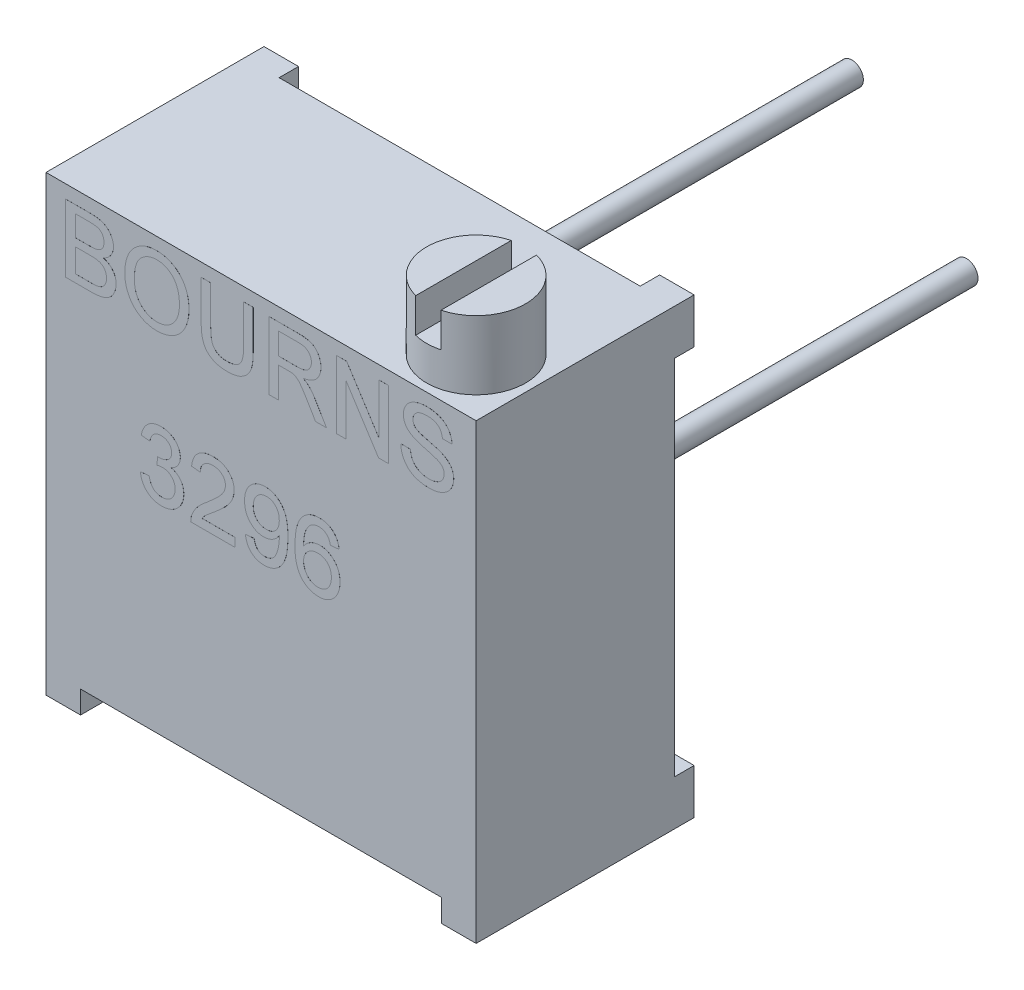
from build123d import *

# Parameters (mm, degrees)
SKETCH1_W          = 9.53
SKETCH1_H          = 10.03
EXTRUDE1_DEPTH     = 4.4
SKETCH2_W          = 8
SKETCH2_H          = 0.5
CUT_EXTRUDE1_DEPTH = 12.94429257
SKETCH3_W          = 0.765
SKETCH3_H          = 1
EXTRUDE2_DEPTH     = 0.43
SKETCH5_R          = 1.095
EXTRUDE4_DEPTH     = 1.52
SKETCH6_W          = 0.56
SKETCH6_H          = 3.177194403
CUT_EXTRUDE2_DEPTH = 0.76
EXTRUDE5_DEPTH     = 0.001
SKETCH8_R          = 0.255
EXTRUDE6_DEPTH     = 8.69


with BuildPart() as part:
    # Sketch1 → Extrude1 (new body)
    with BuildSketch(Plane.XY):
        with Locations((0, 5.015)):
            Rectangle(SKETCH1_W, SKETCH1_H)
    extrude(amount=EXTRUDE1_DEPTH)

    # Sketch2 → Cut-Extrude1 (cut, through all)
    with BuildSketch(Plane.XY.offset(4.4)):
        with Locations((0, 0.25)):
            Rectangle(SKETCH2_W, SKETCH2_H)
    extrude(amount=-CUT_EXTRUDE1_DEPTH, mode=Mode.SUBTRACT)

    # Sketch3 → Extrude2 (add)
    with BuildSketch(Plane(origin=(0, 0, 0), x_dir=(-1, 0, 0), z_dir=(0, 0, -1))):
        with Locations((-4.3825, 0.5)):
            Rectangle(SKETCH3_W, SKETCH3_H)
        with Locations((4.3825, 0.5)):
            Rectangle(SKETCH3_W, SKETCH3_H)
        with Locations((4.3825, 9.53)):
            Rectangle(SKETCH3_W, SKETCH3_H)
        with Locations((-4.3825, 9.53)):
            Rectangle(SKETCH3_W, SKETCH3_H)
    extrude(amount=EXTRUDE2_DEPTH)

    # Sketch5 → Extrude4 (add)
    with BuildSketch(Plane(origin=(0, 10.03, 0), x_dir=(-1, 0, 0), z_dir=(0, 1, 0))):
        with Locations(Location((-3.495, 3.13, 0), (0, 0, 270))):
            Circle(SKETCH5_R)
    extrude(amount=EXTRUDE4_DEPTH)

    # Sketch6 → Cut-Extrude2 (cut)
    with BuildSketch(Plane(origin=(0, 11.55, 0), x_dir=(-1, 0, 0), z_dir=(0, 1, 0))):
        with Locations((-3.495, 3.181606458)):
            Rectangle(SKETCH6_W, SKETCH6_H)
    extrude(amount=-CUT_EXTRUDE2_DEPTH, mode=Mode.SUBTRACT)

    # Sketch7 → Extrude5 (add)
    # profile 1 of 10: a face of its own
    with BuildSketch(Plane.XY.offset(4.4)):
        with BuildLine():
            Line((-4.326444342, 8.237150921), (-4.326444342, 9.737150921))
            Line((-4.326444342, 9.737150921), (-3.764845784, 9.737150921))
            add(Edge.make_bspline(
                [(-3.764845784, 9.737150921), (-3.750919069, 9.737097495), (-3.723744088, 9.736993245), (-3.684062996, 9.734386066), (-3.64648204, 9.730819986), (-3.610920315, 9.726223199), (-3.577531697, 9.719553354), (-3.5463473, 9.711473284), (-3.517204841, 9.702153183), (-3.481582627, 9.687955652), (-3.44053193, 9.666102632), (-3.396562734, 9.63349448), (-3.358307825, 9.594343785), (-3.326829661, 9.549455296), (-3.300895048, 9.501505925), (-3.282507712, 9.451409151), (-3.270751692, 9.400255705), (-3.269417834, 9.365618225), (-3.268752034, 9.348328806)],
                knots=[0, 0, 0, 0, 0.939712594, 1.833646414, 2.682508961, 3.487467313, 4.25240329, 4.978730417, 5.660668875, 6.315918528, 7.564895217, 8.787077865, 9.996481721, 11.241996224, 12.475862915, 13.665015424, 14.834484263, 16, 16, 16, 16], degree=3))
            add(Edge.make_bspline(
                [(-3.268752034, 9.348328806), (-3.26945193, 9.332243346), (-3.270844975, 9.300227505), (-3.281932051, 9.253066225), (-3.29943085, 9.207272915), (-3.324174647, 9.163404285), (-3.35580032, 9.122262901), (-3.395007125, 9.085240754), (-3.441231661, 9.052258501), (-3.475923175, 9.03467799), (-3.49381213, 9.025612459)],
                knots=[0, 0, 0, 0, 0.926741525, 1.844548388, 2.778836836, 3.746021974, 4.738420572, 5.759761325, 6.844803049, 8, 8, 8, 8], degree=3))
            add(Edge.make_bspline(
                [(-3.49381213, 9.025612459), (-3.482745904, 9.022148256), (-3.461080115, 9.015365935), (-3.429933293, 9.002955239), (-3.40069594, 8.988823885), (-3.373304413, 8.972948652), (-3.347943795, 8.955182527), (-3.324685642, 8.935497814), (-3.303368694, 8.914199128), (-3.284031035, 8.891299426), (-3.267044931, 8.866946071), (-3.251810517, 8.841671332), (-3.2392306, 8.815170846), (-3.228919301, 8.787513414), (-3.220874955, 8.758869935), (-3.215098238, 8.729130241), (-3.211805658, 8.698363557), (-3.211311122, 8.677463121), (-3.211059726, 8.666838421)],
                knots=[0, 0, 0, 0, 1.127427615, 2.20731145, 3.257257018, 4.283066884, 5.282973838, 6.264540225, 7.242620376, 8.210460609, 9.17525685, 10.12748095, 11.077310519, 12.023587065, 12.994999128, 13.967387486, 14.966724908, 16, 16, 16, 16], degree=3))
            add(Edge.make_bspline(
                [(-3.211059726, 8.666838421), (-3.211577892, 8.649780613), (-3.212604959, 8.615969962), (-3.220853456, 8.56620637), (-3.234792977, 8.518337989), (-3.253979542, 8.473138792), (-3.276841107, 8.43134548), (-3.302824076, 8.394052338), (-3.331265831, 8.36164311), (-3.362967261, 8.334381157), (-3.397723879, 8.311243736), (-3.436517359, 8.291760514), (-3.479047757, 8.27457818), (-3.526179479, 8.260852297), (-3.577891071, 8.249948474), (-3.634884306, 8.242864242), (-3.697246747, 8.237792882), (-3.74069542, 8.237370888), (-3.76334338, 8.237150921)],
                knots=[0, 0, 0, 0, 1.028073207, 2.037766189, 3.031549473, 4.027532207, 4.992436545, 5.898794514, 6.762903869, 7.584966804, 8.412380356, 9.273953678, 10.198004568, 11.174406109, 12.229717296, 13.381036288, 14.634844708, 16, 16, 16, 16], degree=3))
            Line((-3.76334338, 8.237150921), (-4.326444342, 8.237150921))
        make_face()
        with BuildLine():
            Line((-4.11490588, 9.102535536), (-3.805711169, 9.102535536))
            add(Edge.make_bspline(
                [(-3.805711169, 9.102535536), (-3.795593548, 9.102575565), (-3.776155313, 9.10265247), (-3.748116122, 9.103724756), (-3.722237293, 9.104639569), (-3.698618928, 9.106935678), (-3.677144021, 9.109184615), (-3.65789851, 9.112212035), (-3.640788132, 9.115623251), (-3.630311444, 9.11878741), (-3.625422707, 9.120263902)],
                knots=[0, 0, 0, 0, 1.335841395, 2.566453063, 3.705076039, 4.753984432, 5.69893722, 6.555639608, 7.326018133, 8, 8, 8, 8], degree=3))
            add(Edge.make_bspline(
                [(-3.625422707, 9.120263902), (-3.613935929, 9.124287721), (-3.591791825, 9.132044802), (-3.562116654, 9.149661914), (-3.536842034, 9.170802362), (-3.516035695, 9.195839435), (-3.500047055, 9.224639144), (-3.48819194, 9.256604254), (-3.481701001, 9.292181608), (-3.480773445, 9.316853252), (-3.480290496, 9.329698998)],
                knots=[0, 0, 0, 0, 1.059015028, 2.041559358, 2.989777133, 3.920090524, 4.862499371, 5.848878527, 6.879979022, 8, 8, 8, 8], degree=3))
            add(Edge.make_bspline(
                [(-3.480290496, 9.329698998), (-3.480678819, 9.342044591), (-3.481435618, 9.366104727), (-3.487788265, 9.401044217), (-3.498781285, 9.433548996), (-3.513668845, 9.463611935), (-3.532520451, 9.490357237), (-3.555020501, 9.513351936), (-3.581973973, 9.530734916), (-3.607167395, 9.541578455), (-3.629826882, 9.548362111), (-3.650072338, 9.552375722), (-3.673036723, 9.555912112), (-3.698795607, 9.558918633), (-3.727358734, 9.56125197), (-3.758814112, 9.563105652), (-3.793086864, 9.56389268), (-3.816828774, 9.564012054), (-3.829148669, 9.564073998)],
                knots=[0, 0, 0, 0, 1.216168307, 2.37017178, 3.484610845, 4.588286376, 5.664695412, 6.69777344, 7.738183022, 8.803673002, 9.390844981, 10.0665252, 10.835811589, 11.680682236, 12.621801058, 13.660007223, 14.785756265, 16, 16, 16, 16], degree=3))
            Line((-3.829148669, 9.564073998), (-4.11490588, 9.564073998))
            Line((-4.11490588, 9.564073998), (-4.11490588, 9.102535536))
        make_face(mode=Mode.SUBTRACT)
        with BuildLine():
            Line((-4.11490588, 8.410227844), (-3.760038092, 8.410227844))
            add(Edge.make_bspline(
                [(-3.760038092, 8.410227844), (-3.745915172, 8.410390096), (-3.719967473, 8.410688199), (-3.68447609, 8.41162336), (-3.655788079, 8.41390761), (-3.639035797, 8.416367164), (-3.631732803, 8.417439383)],
                knots=[0, 0, 0, 0, 1.317581857, 2.420761387, 3.311546315, 4, 4, 4, 4], degree=3))
            add(Edge.make_bspline(
                [(-3.631732803, 8.417439383), (-3.621262478, 8.419640139), (-3.60098922, 8.423901372), (-3.572408792, 8.433412), (-3.546204152, 8.444306931), (-3.522832664, 8.458153179), (-3.501191226, 8.47411003), (-3.482383206, 8.494040902), (-3.465060127, 8.516685746), (-3.450051204, 8.542600195), (-3.43791431, 8.571268479), (-3.42863829, 8.602247654), (-3.423697206, 8.635429101), (-3.422969697, 8.658209966), (-3.422598188, 8.669843229)],
                knots=[0, 0, 0, 0, 1.067651492, 2.067249321, 3.003744366, 3.895862395, 4.774133402, 5.679610569, 6.621910665, 7.616993802, 8.661192143, 9.724711987, 10.838102842, 12, 12, 12, 12], degree=3))
            add(Edge.make_bspline(
                [(-3.422598188, 8.669843229), (-3.42301209, 8.683501376), (-3.42381924, 8.710136157), (-3.431491485, 8.748624765), (-3.444164778, 8.784323428), (-3.462005081, 8.816737755), (-3.483887144, 8.845891651), (-3.51036223, 8.870622107), (-3.541232376, 8.890246947), (-3.576592458, 8.905648649), (-3.617921311, 8.916606694), (-3.666359943, 8.924041064), (-3.722683143, 8.928838285), (-3.762931606, 8.929242981), (-3.784377034, 8.929458613)],
                knots=[0, 0, 0, 0, 0.96167883, 1.875371887, 2.752872588, 3.621584364, 4.472914353, 5.312011319, 6.159851575, 7.038572308, 8.019870099, 9.164119506, 10.488969081, 12, 12, 12, 12], degree=3))
            Line((-3.784377034, 8.929458613), (-4.11490588, 8.929458613))
            Line((-4.11490588, 8.929458613), (-4.11490588, 8.410227844))
        make_face(mode=Mode.SUBTRACT)
    # profile 2 of 10: a face of its own
    with BuildSketch(Plane.XY.offset(4.4)):
        with BuildLine():
            add(Edge.make_bspline(
                [(-3.018752034, 8.96731919), (-3.018230692, 8.997392897), (-3.017214883, 9.055989991), (-3.007723632, 9.141314909), (-2.992312277, 9.221594495), (-2.970280381, 9.296822497), (-2.942354889, 9.367116795), (-2.90840612, 9.432636561), (-2.867412916, 9.492640158), (-2.821039156, 9.547698782), (-2.769241797, 9.596374641), (-2.714092331, 9.639605778), (-2.654902115, 9.675665657), (-2.592218021, 9.705439229), (-2.525773732, 9.728298516), (-2.455755803, 9.744302096), (-2.382239117, 9.754625961), (-2.331988742, 9.755787946), (-2.30631213, 9.75638169)],
                knots=[0, 0, 0, 0, 1.203621547, 2.345195544, 3.432004029, 4.472479546, 5.478447225, 6.455936844, 7.420185704, 8.381829745, 9.332027588, 10.260832629, 11.182364398, 12.100723901, 13.034044877, 13.989196293, 14.972532542, 16, 16, 16, 16], degree=3))
            add(Edge.make_bspline(
                [(-2.30631213, 9.75638169), (-2.289376641, 9.756085965), (-2.255745821, 9.755498707), (-2.206025657, 9.751030463), (-2.157583125, 9.74305542), (-2.110465931, 9.732367968), (-2.064545821, 9.718346497), (-2.019795371, 9.701794576), (-1.976606323, 9.681284416), (-1.934691352, 9.658321251), (-1.894545231, 9.632635958), (-1.856816008, 9.604261466), (-1.821594055, 9.573412372), (-1.788406246, 9.540595749), (-1.758360012, 9.504704083), (-1.730214065, 9.466830696), (-1.704777197, 9.426304031), (-1.681959152, 9.383456134), (-1.661557501, 9.338948785), (-1.644120351, 9.292597519), (-1.629147388, 9.24495835), (-1.616613755, 9.195749307), (-1.607620535, 9.144987212), (-1.600459136, 9.092890794), (-1.596689895, 9.039289785), (-1.596016226, 9.003081348), (-1.595675111, 8.984747075)],
                knots=[0, 0, 0, 0, 1.034375294, 2.054082248, 3.045783978, 4.031219655, 5.002789406, 5.976610191, 6.94273282, 7.920236376, 8.894345378, 9.851183672, 10.800797181, 11.752517031, 12.698794154, 13.65688337, 14.632873302, 15.61821402, 16.620222298, 17.621258913, 18.640965868, 19.669244166, 20.720417492, 21.788124603, 22.880008887, 24, 24, 24, 24], degree=3))
            add(Edge.make_bspline(
                [(-1.595675111, 8.984747075), (-1.595987646, 8.966110469), (-1.596605114, 8.929290641), (-1.600783152, 8.87489649), (-1.608129594, 8.822063882), (-1.617873399, 8.77063528), (-1.630929801, 8.720717747), (-1.646445328, 8.672168168), (-1.665212234, 8.625275712), (-1.686407371, 8.579927361), (-1.71038966, 8.536746809), (-1.736843752, 8.496035998), (-1.765788388, 8.458175743), (-1.796783902, 8.422701596), (-1.830554122, 8.390247902), (-1.866683213, 8.360511195), (-1.90503226, 8.333211022), (-1.945730096, 8.30908676), (-1.988046343, 8.287940982), (-2.031143628, 8.269180868), (-2.075053966, 8.253181495), (-2.119927428, 8.240215594), (-2.165641605, 8.230417626), (-2.21206785, 8.223080805), (-2.259358356, 8.218856237), (-2.291179863, 8.218233784), (-2.307213572, 8.217920152)],
                knots=[0, 0, 0, 0, 1.141429366, 2.255090526, 3.338676798, 4.407031443, 5.458968682, 6.496860253, 7.526652771, 8.550250826, 9.560787671, 10.54935636, 11.521089193, 12.477323897, 13.431786008, 14.386110112, 15.340986122, 16.312041, 17.28047646, 18.236612773, 19.189437236, 20.140779471, 21.09494583, 22.051062463, 23.018000708, 24, 24, 24, 24], degree=3))
            add(Edge.make_bspline(
                [(-2.307213572, 8.217920152), (-2.324453371, 8.218175217), (-2.358601094, 8.218680436), (-2.409072348, 8.223723391), (-2.458287957, 8.231416594), (-2.506104842, 8.242523255), (-2.552457663, 8.25701268), (-2.597401266, 8.27455022), (-2.641093722, 8.294901493), (-2.682992881, 8.318649222), (-2.722956135, 8.345054144), (-2.760596145, 8.373985002), (-2.795892098, 8.405175171), (-2.828277639, 8.439140188), (-2.858801633, 8.474648809), (-2.886243593, 8.513020865), (-2.911499732, 8.55338612), (-2.933822678, 8.596133677), (-2.95398812, 8.639993241), (-2.97097794, 8.68497884), (-2.985908699, 8.730427507), (-2.997799537, 8.776619369), (-3.007275088, 8.823447871), (-3.01364671, 8.870835093), (-3.018248343, 8.918851609), (-3.018583292, 8.951082028), (-3.018752034, 8.96731919)],
                knots=[0, 0, 0, 0, 1.072727997, 2.12480551, 3.153819198, 4.171534612, 5.177148798, 6.173931848, 7.17235114, 8.174500385, 9.168706755, 10.151274001, 11.127173509, 12.097141049, 13.070188938, 14.039134204, 15.03036519, 16.031505612, 17.038625933, 18.033164522, 19.022845559, 20.014762458, 21.000193215, 21.994692725, 22.989758729, 24, 24, 24, 24], degree=3))
        make_face()
        with BuildLine():
            add(Edge.make_bspline(
                [(-2.807213572, 8.964915344), (-2.8068894, 8.943259561), (-2.806257286, 8.901032314), (-2.799025562, 8.839467232), (-2.788052575, 8.781377442), (-2.772927471, 8.726599873), (-2.752595628, 8.675676265), (-2.728286277, 8.628117292), (-2.699180916, 8.584239101), (-2.665921697, 8.544164434), (-2.629340369, 8.508164356), (-2.590249507, 8.476720203), (-2.548640324, 8.450387949), (-2.504974133, 8.428645052), (-2.458937298, 8.411672739), (-2.410667702, 8.399755208), (-2.360129877, 8.39230176), (-2.325669313, 8.391437388), (-2.308115015, 8.390997075)],
                knots=[0, 0, 0, 0, 1.215430442, 2.370003584, 3.475209778, 4.53279855, 5.55522989, 6.548792651, 7.526809858, 8.505409025, 9.467826767, 10.404123909, 11.316848639, 12.227335424, 13.138360512, 14.065900994, 15.014765094, 16, 16, 16, 16], degree=3))
            add(Edge.make_bspline(
                [(-2.308115015, 8.390997075), (-2.290263171, 8.3914439), (-2.25530931, 8.392318784), (-2.204009559, 8.399642118), (-2.155269053, 8.412109783), (-2.108604686, 8.42870707), (-2.064860106, 8.451143772), (-2.02301225, 8.477417027), (-1.984201898, 8.509522192), (-1.947476365, 8.54558594), (-1.914536035, 8.586579013), (-1.885308427, 8.631491621), (-1.861565976, 8.680997339), (-1.841067574, 8.734005623), (-1.826057462, 8.791518352), (-1.81496407, 8.85288172), (-1.808278957, 8.918293114), (-1.80757498, 8.963196823), (-1.807213572, 8.986249479)],
                knots=[0, 0, 0, 0, 0.976878588, 1.912725521, 2.8289017, 3.727303729, 4.617335839, 5.514666588, 6.426584173, 7.368641557, 8.327632997, 9.299405846, 10.294892156, 11.327373912, 12.405931897, 13.542618837, 14.738430195, 16, 16, 16, 16], degree=3))
            add(Edge.make_bspline(
                [(-1.807213572, 8.986249479), (-1.807341294, 9.001080057), (-1.807591837, 9.030172285), (-1.810909864, 9.073054562), (-1.815189695, 9.114602954), (-1.821705802, 9.15476385), (-1.830685826, 9.193370934), (-1.840634167, 9.230718122), (-1.853074219, 9.266483577), (-1.867189192, 9.300807558), (-1.882983608, 9.333513851), (-1.900797609, 9.36432673), (-1.920424159, 9.3931264), (-1.941333711, 9.420458875), (-1.964684118, 9.445266276), (-1.989351045, 9.468596479), (-2.015894798, 9.489967476), (-2.044050482, 9.509384851), (-2.073418672, 9.526863548), (-2.103938825, 9.541823045), (-2.135124711, 9.554963084), (-2.167498339, 9.565035475), (-2.200612691, 9.573159006), (-2.234601633, 9.579329585), (-2.269591323, 9.582524997), (-2.293185557, 9.583042977), (-2.305110207, 9.583304767)],
                knots=[0, 0, 0, 0, 1.220438779, 2.394059227, 3.538503547, 4.658058814, 5.74010225, 6.800155734, 7.837851593, 8.854470756, 9.853724944, 10.825214244, 11.781044712, 12.72106398, 13.654479919, 14.581868691, 15.514082315, 16.456304431, 17.39516604, 18.324312202, 19.252140633, 20.177768678, 21.111585046, 22.057694709, 23.018348693, 24, 24, 24, 24], degree=3))
            add(Edge.make_bspline(
                [(-2.305110207, 9.583304767), (-2.321964073, 9.582970056), (-2.355218629, 9.582309634), (-2.404173295, 9.574968014), (-2.4513709, 9.56399863), (-2.496884691, 9.548662848), (-2.540325395, 9.528355862), (-2.581918075, 9.503452123), (-2.622031926, 9.47462972), (-2.660034411, 9.441186401), (-2.695461039, 9.402768193), (-2.725410699, 9.357474302), (-2.750653091, 9.30638599), (-2.771730023, 9.249632752), (-2.787800563, 9.186775074), (-2.798907316, 9.11808346), (-2.805919894, 9.043485528), (-2.806771322, 8.991774955), (-2.807213572, 8.964915344)],
                knots=[0, 0, 0, 0, 0.895090134, 1.766112571, 2.624765742, 3.468151641, 4.313618154, 5.168136083, 6.041303099, 6.935189387, 7.854749729, 8.809996334, 9.809869957, 10.877771942, 12.021723904, 13.25217762, 14.572720513, 16, 16, 16, 16], degree=3))
        make_face(mode=Mode.SUBTRACT)
    # profile 3 of 10: a face of its own
    with BuildSketch(Plane.XY.offset(4.4)):
        with BuildLine():
            Line((-0.384136649, 9.737150921), (-0.172598188, 9.737150921))
            Line((-0.172598188, 9.737150921), (-0.172598188, 8.874170152))
            add(Edge.make_bspline(
                [(-0.172598188, 8.874170152), (-0.172817713, 8.855839279), (-0.17324491, 8.820167371), (-0.175210197, 8.768143941), (-0.179038667, 8.719011196), (-0.184899968, 8.672848597), (-0.19152619, 8.629455925), (-0.200351288, 8.589070404), (-0.210472953, 8.551529041), (-0.222118871, 8.516578197), (-0.236215171, 8.483981753), (-0.252320236, 8.453041696), (-0.27110134, 8.423667691), (-0.292509773, 8.395904321), (-0.316659126, 8.369903341), (-0.342889972, 8.34499824), (-0.371894747, 8.32187367), (-0.403354379, 8.300264922), (-0.437307933, 8.280653275), (-0.473904053, 8.263733066), (-0.513098094, 8.24978275), (-0.554713075, 8.237914738), (-0.59895675, 8.229115881), (-0.645687182, 8.222441781), (-0.694966239, 8.218516166), (-0.728680904, 8.218121765), (-0.745915496, 8.217920152)],
                knots=[0, 0, 0, 0, 1.311435591, 2.552055809, 3.723716842, 4.835547674, 5.880436826, 6.862821995, 7.791032428, 8.661143393, 9.495683908, 10.328993084, 11.1538804, 11.986573222, 12.833449924, 13.690091648, 14.571895854, 15.484149563, 16.418232274, 17.373591634, 18.364096258, 19.391643703, 20.466661433, 21.588422397, 22.767226238, 24, 24, 24, 24], degree=3))
            add(Edge.make_bspline(
                [(-0.745915496, 8.217920152), (-0.762747176, 8.218167913), (-0.795542393, 8.218650658), (-0.843600901, 8.221914973), (-0.889315102, 8.227699697), (-0.932822961, 8.235291305), (-0.973978437, 8.245579942), (-1.01272043, 8.258173326), (-1.049181209, 8.272904412), (-1.083365134, 8.2896649), (-1.11487259, 8.309015777), (-1.144260591, 8.330138013), (-1.171397739, 8.353261603), (-1.19603194, 8.378594967), (-1.218455258, 8.405756623), (-1.238355176, 8.435036855), (-1.255779343, 8.466487887), (-1.271165901, 8.500026899), (-1.284571795, 8.536147585), (-1.295381776, 8.575342209), (-1.305161568, 8.617510171), (-1.312667758, 8.662804669), (-1.319261137, 8.711168829), (-1.323084681, 8.762745583), (-1.325997838, 8.817446196), (-1.326292931, 8.854934905), (-1.326444342, 8.874170152)],
                knots=[0, 0, 0, 0, 1.192889473, 2.324252067, 3.41162405, 4.457325556, 5.452435892, 6.415456921, 7.342133401, 8.237363544, 9.110250727, 9.959377435, 10.800155199, 11.633438097, 12.46053001, 13.293359256, 14.138649731, 15.005774073, 15.906391469, 16.865847877, 17.8852706, 18.972920589, 20.118424796, 21.343408205, 22.636917643, 24, 24, 24, 24], degree=3))
            Line((-1.326444342, 8.874170152), (-1.326444342, 9.737150921))
            Line((-1.326444342, 9.737150921), (-1.11490588, 9.737150921))
            Line((-1.11490588, 9.737150921), (-1.11490588, 8.884086017))
            add(Edge.make_bspline(
                [(-1.11490588, 8.884086017), (-1.114767658, 8.868560422), (-1.114500957, 8.838603557), (-1.113109482, 8.795207672), (-1.110326775, 8.754936554), (-1.106886612, 8.717728723), (-1.102157025, 8.683718544), (-1.09610028, 8.652955825), (-1.089306625, 8.625335805), (-1.079133218, 8.593035516), (-1.062246323, 8.556979041), (-1.035633784, 8.518762127), (-1.003161194, 8.485560874), (-0.964517851, 8.458141879), (-0.920633994, 8.436355447), (-0.871805449, 8.421333433), (-0.818611502, 8.411672805), (-0.781617528, 8.410721136), (-0.762441938, 8.410227844)],
                knots=[0, 0, 0, 0, 1.090245215, 2.103644224, 3.048223674, 3.924421557, 4.727106666, 5.45815927, 6.12513286, 6.723455763, 7.834131158, 8.905266051, 9.9795367, 11.078391299, 12.21701853, 13.404826756, 14.65480846, 16, 16, 16, 16], degree=3))
            add(Edge.make_bspline(
                [(-0.762441938, 8.410227844), (-0.746007063, 8.410507631), (-0.714272984, 8.411047872), (-0.668513344, 8.415404728), (-0.6265627, 8.423347367), (-0.588072882, 8.433582839), (-0.553314751, 8.447483141), (-0.522075787, 8.464324146), (-0.494465601, 8.484196483), (-0.470286071, 8.507638528), (-0.449452221, 8.535691341), (-0.431893065, 8.569123488), (-0.416934773, 8.607964106), (-0.404676645, 8.652341416), (-0.395738752, 8.702466188), (-0.388751711, 8.758015588), (-0.385088051, 8.819233831), (-0.384462913, 8.861846319), (-0.384136649, 8.884086017)],
                knots=[0, 0, 0, 0, 1.111629428, 2.146443922, 3.104513091, 3.997025448, 4.836178689, 5.630482806, 6.392099463, 7.129930272, 7.899580577, 8.745272349, 9.676297551, 10.710246713, 11.854352966, 13.117392195, 14.495550762, 16, 16, 16, 16], degree=3))
            Line((-0.384136649, 8.884086017), (-0.384136649, 9.737150921))
        make_face()
    # profile 4 of 10: a face of its own
    with BuildSketch(Plane.XY.offset(4.4)):
        with BuildLine():
            Line((0.173555658, 8.237150921), (0.173555658, 9.737150921))
            Line((0.173555658, 9.737150921), (0.824397004, 9.737150921))
            add(Edge.make_bspline(
                [(0.824397004, 9.737150921), (0.839722325, 9.737030841), (0.86938269, 9.73679844), (0.912396343, 9.735153303), (0.952545276, 9.731606819), (0.98990331, 9.727771792), (1.024463806, 9.721885537), (1.05619111, 9.715134136), (1.085134208, 9.707099866), (1.111422492, 9.697610774), (1.135812287, 9.686875288), (1.158419785, 9.673629431), (1.18018475, 9.659114797), (1.200299409, 9.642062268), (1.219294287, 9.623391327), (1.237151779, 9.602848275), (1.25360752, 9.580254841), (1.273903706, 9.547918952), (1.295677375, 9.504854357), (1.313818262, 9.449741006), (1.325515181, 9.39209043), (1.326766785, 9.352692939), (1.327401812, 9.332703806)],
                knots=[0, 0, 0, 0, 1.242255013, 2.404239178, 3.487702428, 4.508875116, 5.447164253, 6.327763259, 7.137389581, 7.87956647, 8.591787438, 9.293660819, 10.000726923, 10.709654955, 11.427269343, 12.158170644, 12.913245971, 13.690346794, 15.251572448, 16.809945773, 18.381459854, 20, 20, 20, 20], degree=3))
            add(Edge.make_bspline(
                [(1.327401812, 9.332703806), (1.327108288, 9.319872565), (1.326528558, 9.294529983), (1.322087769, 9.257269606), (1.314052519, 9.221668814), (1.303748895, 9.187415821), (1.289646376, 9.154995938), (1.273309221, 9.123746979), (1.253069809, 9.094527437), (1.230409548, 9.066559241), (1.204424306, 9.040441395), (1.17488549, 9.017116168), (1.142085913, 8.99613508), (1.105871101, 8.978077007), (1.066657924, 8.96157107), (1.023954363, 8.948279695), (0.977932767, 8.937426268), (0.946028457, 8.93217062), (0.929565274, 8.929458613)],
                knots=[0, 0, 0, 0, 0.982609109, 1.940720374, 2.867584677, 3.775009516, 4.675469332, 5.571146231, 6.471115823, 7.392408543, 8.32534739, 9.286126426, 10.269214477, 11.301811357, 12.381622301, 13.524260118, 14.722474812, 16, 16, 16, 16], degree=3))
            add(Edge.make_bspline(
                [(0.929565274, 8.929458613), (0.941641642, 8.923357898), (0.964575101, 8.911772421), (0.996326759, 8.893606493), (1.02324154, 8.875045391), (1.038834637, 8.861769945), (1.046151812, 8.855540344)],
                knots=[0, 0, 0, 0, 1.172304973, 2.226249348, 3.167654437, 4, 4, 4, 4], degree=3))
            add(Edge.make_bspline(
                [(1.046151812, 8.855540344), (1.060321936, 8.841649482), (1.089428377, 8.813116664), (1.129538316, 8.764516917), (1.16842628, 8.710417941), (1.192053651, 8.671320427), (1.204204697, 8.651213421)],
                knots=[0, 0, 0, 0, 0.918110279, 1.885863737, 2.912745394, 4, 4, 4, 4], degree=3))
            Line((1.204204697, 8.651213421), (1.450298447, 8.237150921))
            Line((1.450298447, 8.237150921), (1.207810466, 8.237150921))
            Line((1.207810466, 8.237150921), (1.020911428, 8.553857652))
            add(Edge.make_bspline(
                [(1.020911428, 8.553857652), (1.014191477, 8.564969688), (1.001169316, 8.58650299), (0.982359271, 8.617951341), (0.96391664, 8.646904558), (0.946811416, 8.674190141), (0.930349439, 8.699312734), (0.914689771, 8.722359607), (0.900263372, 8.743633105), (0.882394413, 8.768400992), (0.861597912, 8.79580689), (0.837329822, 8.82402979), (0.814219405, 8.846531531), (0.7857585, 8.868596883), (0.750505364, 8.88923531), (0.720539532, 8.898718101), (0.706007581, 8.903316786)],
                knots=[0, 0, 0, 0, 1.130940588, 2.191577161, 3.191089816, 4.120344442, 4.99615009, 5.80661983, 6.546979556, 7.234477901, 8.466216387, 9.541989141, 10.473533583, 11.269175393, 12.675684693, 14, 14, 14, 14], degree=3))
            add(Edge.make_bspline(
                [(0.706007581, 8.903316786), (0.699910513, 8.904416295), (0.685990724, 8.906926506), (0.662354957, 8.908565929), (0.633717326, 8.910305957), (0.612963146, 8.910255258), (0.601740754, 8.910227844)],
                knots=[0, 0, 0, 0, 0.709978628, 1.620902492, 2.713552433, 4, 4, 4, 4], degree=3))
            Line((0.601740754, 8.910227844), (0.38509412, 8.910227844))
            Line((0.38509412, 8.910227844), (0.38509412, 8.237150921))
            Line((0.38509412, 8.237150921), (0.173555658, 8.237150921))
        make_face()
        with BuildLine():
            Line((0.38509412, 9.083304767), (0.786836908, 9.083304767))
            add(Edge.make_bspline(
                [(0.786836908, 9.083304767), (0.806981813, 9.083619953), (0.844640824, 9.084209164), (0.897300993, 9.089240406), (0.942179174, 9.097235264), (0.980162544, 9.108896699), (1.012074571, 9.125086645), (1.039829066, 9.144817119), (1.062893402, 9.169531591), (1.082080546, 9.197416611), (1.096995107, 9.228102684), (1.10775376, 9.260333904), (1.114795486, 9.29383939), (1.115504243, 9.31664276), (1.115863351, 9.328196594)],
                knots=[0, 0, 0, 0, 1.546323217, 2.890706218, 4.056530419, 5.041445823, 5.928701482, 6.793137403, 7.641659452, 8.509781392, 9.383301667, 10.251423607, 11.114044887, 12, 12, 12, 12], degree=3))
            add(Edge.make_bspline(
                [(1.115863351, 9.328196594), (1.115584159, 9.336616312), (1.115037306, 9.353108067), (1.11217052, 9.377313385), (1.106596807, 9.400314031), (1.099236732, 9.422231591), (1.089402179, 9.442905533), (1.07771913, 9.462496058), (1.063777647, 9.480894587), (1.047808481, 9.498157164), (1.029472975, 9.513864423), (1.008529518, 9.52741638), (0.985143287, 9.538932621), (0.959287102, 9.548072679), (0.931042413, 9.555383237), (0.90024843, 9.560246716), (0.86704598, 9.563765913), (0.844038607, 9.563969384), (0.832209504, 9.564073998)],
                knots=[0, 0, 0, 0, 0.965208469, 1.890559848, 2.786986821, 3.67262109, 4.535197034, 5.405224191, 6.282113641, 7.175449223, 8.095446547, 9.040936516, 10.026471658, 11.075712529, 12.17809725, 13.364958037, 14.645208957, 16, 16, 16, 16], degree=3))
            Line((0.832209504, 9.564073998), (0.38509412, 9.564073998))
            Line((0.38509412, 9.564073998), (0.38509412, 9.083304767))
        make_face(mode=Mode.SUBTRACT)
    # profile 5 of 10: a face of its own
    with BuildSketch(Plane.XY.offset(4.4)):
        Polygon((1.673555658, 8.237150921), (1.673555658, 9.737150921), (1.897113351, 9.737150921), (2.615863351, 8.617860056), (2.615863351, 9.737150921), (2.827401812, 9.737150921), (2.827401812, 8.237150921), (2.60384412, 8.237150921), (1.88509412, 9.356441786), (1.88509412, 8.237150921), align=None)
    # profile 6 of 10: a face of its own
    with BuildSketch(Plane.XY.offset(4.4)):
        with BuildLine():
            Line((3.096632581, 8.75638169), (3.308171043, 8.75638169))
            add(Edge.make_bspline(
                [(3.308171043, 8.75638169), (3.310497843, 8.737388445), (3.314967752, 8.700901399), (3.327466063, 8.649186503), (3.343552197, 8.602689505), (3.363595075, 8.560793306), (3.389960718, 8.52400024), (3.421726783, 8.490813457), (3.460304939, 8.462075712), (3.503850884, 8.436501001), (3.552348913, 8.416420809), (3.604124885, 8.401535032), (3.658931873, 8.39271509), (3.696460325, 8.391577796), (3.715622966, 8.390997075)],
                knots=[0, 0, 0, 0, 1.125557648, 2.162256852, 3.1243583, 4.018160113, 4.88511607, 5.777380551, 6.711250965, 7.707237736, 8.743031335, 9.791730543, 10.872421559, 12, 12, 12, 12], degree=3))
            add(Edge.make_bspline(
                [(3.715622966, 8.390997075), (3.732580253, 8.391310936), (3.765643678, 8.391922905), (3.813473618, 8.399274166), (3.858481731, 8.409701733), (3.899830369, 8.42547506), (3.937367, 8.444628825), (3.969963359, 8.467795753), (3.997792396, 8.493921683), (4.019584549, 8.523694759), (4.03670403, 8.554891964), (4.049262938, 8.586959473), (4.056744023, 8.619719296), (4.057697308, 8.641761795), (4.058171043, 8.652715825)],
                knots=[0, 0, 0, 0, 1.267006637, 2.470417599, 3.611360613, 4.716023143, 5.771382139, 6.754486395, 7.697536124, 8.612899418, 9.501261124, 10.352596716, 11.181322154, 12, 12, 12, 12], degree=3))
            add(Edge.make_bspline(
                [(4.058171043, 8.652715825), (4.057664611, 8.663558897), (4.056674791, 8.684751666), (4.050224406, 8.71560569), (4.037964538, 8.743846084), (4.022055951, 8.770625489), (3.99992439, 8.795109454), (3.97196366, 8.817669243), (3.937557717, 8.838122166), (3.911878856, 8.849323379), (3.898315274, 8.855239863)],
                knots=[0, 0, 0, 0, 0.942140154, 1.841411588, 2.718743672, 3.605002079, 4.535543111, 5.568170452, 6.715506882, 8, 8, 8, 8], degree=3))
            add(Edge.make_bspline(
                [(3.898315274, 8.855239863), (3.893030701, 8.857408477), (3.881091893, 8.86230777), (3.860629335, 8.868793591), (3.836347919, 8.877180419), (3.807664303, 8.885817486), (3.774732043, 8.894954296), (3.737605968, 8.905295779), (3.696306823, 8.91629338), (3.652005924, 8.927999128), (3.607275516, 8.93990208), (3.564540836, 8.951816178), (3.5252229, 8.963910513), (3.488999639, 8.975555689), (3.456057801, 8.987248909), (3.42630389, 8.998670037), (3.39970081, 9.009587356), (3.383452661, 9.017614692), (3.375779216, 9.021405729)],
                knots=[0, 0, 0, 0, 0.499201778, 1.127787504, 1.87543728, 2.745208432, 3.745951656, 4.863402235, 6.114490242, 7.482339553, 8.869366102, 10.161191451, 11.360587006, 12.46547846, 13.487450326, 14.41601931, 15.251940103, 16, 16, 16, 16], degree=3))
            add(Edge.make_bspline(
                [(3.375779216, 9.021405729), (3.35812476, 9.030943175), (3.324047064, 9.049352927), (3.278182261, 9.082269616), (3.239536508, 9.118796776), (3.208272844, 9.158881439), (3.183772734, 9.201845678), (3.167242617, 9.247762533), (3.155920851, 9.295798527), (3.154862803, 9.328830804), (3.154324889, 9.345624479)],
                knots=[0, 0, 0, 0, 1.158441928, 2.236094408, 3.251151369, 4.220012324, 5.163146324, 6.095083285, 7.031536583, 8, 8, 8, 8], degree=3))
            add(Edge.make_bspline(
                [(3.154324889, 9.345624479), (3.155038808, 9.364220637), (3.156458787, 9.40120826), (3.169054782, 9.455485292), (3.189145635, 9.507714234), (3.212015126, 9.549179557), (3.234317935, 9.580535449), (3.252807132, 9.603117389), (3.273546383, 9.623991357), (3.295896991, 9.643448738), (3.320258496, 9.661198819), (3.346026486, 9.677971103), (3.374133618, 9.692387284), (3.413628319, 9.710735829), (3.466462713, 9.729058566), (3.532974606, 9.745024508), (3.60297619, 9.754426519), (3.650690914, 9.755720748), (3.675058062, 9.75638169)],
                knots=[0, 0, 0, 0, 1.199927478, 2.386647047, 3.578628709, 4.806592355, 5.433127754, 6.062729195, 6.689531802, 7.331674828, 7.974827539, 8.635320743, 9.315455226, 10.01318112, 11.447700238, 12.918145351, 14.426146008, 16, 16, 16, 16], degree=3))
            add(Edge.make_bspline(
                [(3.675058062, 9.75638169), (3.701729524, 9.755770554), (3.753664, 9.754580555), (3.829126262, 9.744679979), (3.899511893, 9.727678083), (3.954710721, 9.708646167), (3.995518568, 9.689378935), (4.024509599, 9.674344909), (4.051419009, 9.656962836), (4.076489036, 9.638152714), (4.099952547, 9.617923133), (4.121206478, 9.595792899), (4.141173733, 9.572517055), (4.16463804, 9.539100235), (4.189937537, 9.494873263), (4.211812397, 9.437575464), (4.22684068, 9.377102341), (4.229764027, 9.335295723), (4.231247966, 9.314073998)],
                knots=[0, 0, 0, 0, 1.607600973, 3.130308851, 4.577334065, 5.967726088, 6.640410691, 7.296826776, 7.935019992, 8.569057421, 9.185393759, 9.8003086, 10.417295362, 11.032210203, 12.259799365, 13.477607022, 14.719591916, 16, 16, 16, 16], degree=3))
            Line((4.231247966, 9.314073998), (4.019709504, 9.314073998))
            add(Edge.make_bspline(
                [(4.019709504, 9.314073998), (4.01836542, 9.324814934), (4.015735446, 9.345831762), (4.009210828, 9.376256782), (4.000064628, 9.404514172), (3.989351623, 9.43086745), (3.97636522, 9.455042515), (3.96122683, 9.477271498), (3.943752103, 9.497292505), (3.924390679, 9.515634568), (3.902553396, 9.531605384), (3.878352458, 9.545468544), (3.851747016, 9.557179739), (3.822760508, 9.566771589), (3.791387195, 9.574208735), (3.757555718, 9.579679641), (3.721279153, 9.582481538), (3.696296049, 9.583025524), (3.683471524, 9.583304767)],
                knots=[0, 0, 0, 0, 1.074487479, 2.102453544, 3.083708351, 4.020042547, 4.923259678, 5.803182661, 6.684453325, 7.556870173, 8.445961597, 9.363679789, 10.320905216, 11.327237703, 12.390948353, 13.519046902, 14.726457512, 16, 16, 16, 16], degree=3))
            add(Edge.make_bspline(
                [(3.683471524, 9.583304767), (3.670141028, 9.583204288), (3.644336467, 9.583009786), (3.607033047, 9.579464247), (3.572457599, 9.574599641), (3.54066951, 9.567423935), (3.511772912, 9.558030911), (3.48533894, 9.547184123), (3.462107376, 9.533438411), (3.441536651, 9.518127475), (3.423791796, 9.50118677), (3.40849836, 9.483335363), (3.394972496, 9.465097741), (3.384462602, 9.445477024), (3.375905969, 9.425216278), (3.370386, 9.403934666), (3.366477733, 9.382025845), (3.366070975, 9.367077017), (3.365863351, 9.359446594)],
                knots=[0, 0, 0, 0, 1.464176581, 2.834285765, 4.113735764, 5.29917439, 6.409476712, 7.449999357, 8.431575861, 9.367089851, 10.262376129, 11.120706676, 11.948504824, 12.751342953, 13.560717798, 14.359016663, 15.162382702, 16, 16, 16, 16], degree=3))
            add(Edge.make_bspline(
                [(3.365863351, 9.359446594), (3.366410016, 9.346541253), (3.367471042, 9.321493177), (3.378305676, 9.285907411), (3.394969419, 9.25346868), (3.411385861, 9.235818932), (3.419649408, 9.226934575)],
                knots=[0, 0, 0, 0, 1.050964922, 2.039826012, 3.013306874, 4, 4, 4, 4], degree=3))
            add(Edge.make_bspline(
                [(3.419649408, 9.226934575), (3.42485866, 9.222494598), (3.4363786, 9.212675865), (3.457813222, 9.19968192), (3.484388976, 9.186553195), (3.516283435, 9.173502227), (3.553441723, 9.160370577), (3.595803905, 9.146849929), (3.643531332, 9.133421398), (3.695169512, 9.120480787), (3.747336115, 9.107488153), (3.796911925, 9.094545037), (3.842430911, 9.082278526), (3.883820853, 9.070314553), (3.921124591, 9.058686949), (3.954212481, 9.0471521), (3.983352215, 9.036542966), (4.001203746, 9.029078573), (4.009493158, 9.025612459)],
                knots=[0, 0, 0, 0, 0.523891492, 1.158553688, 1.913783773, 2.794766643, 3.797521443, 4.933638669, 6.202080764, 7.596537849, 9.013317056, 10.322179469, 11.523240428, 12.626146501, 13.623953177, 14.517289671, 15.311498917, 16, 16, 16, 16], degree=3))
            add(Edge.make_bspline(
                [(4.009493158, 9.025612459), (4.020278105, 9.020639906), (4.041447148, 9.010879618), (4.071435932, 8.994215394), (4.099418721, 8.976910495), (4.125169432, 8.958499014), (4.148604802, 8.938942223), (4.169986865, 8.9184642), (4.189444761, 8.897180034), (4.206193367, 8.874408509), (4.221231896, 8.851070152), (4.23439161, 8.82683878), (4.244987559, 8.801571892), (4.254280868, 8.775574057), (4.260965422, 8.748556105), (4.266207461, 8.720790933), (4.269265054, 8.692148039), (4.269560074, 8.672754984), (4.269709504, 8.662932171)],
                knots=[0, 0, 0, 0, 1.198900896, 2.353241543, 3.461831299, 4.520043694, 5.547003373, 6.541368882, 7.508191797, 8.454912692, 9.392021408, 10.310662301, 11.235020644, 12.156274873, 13.095836685, 14.042125239, 15.00831306, 16, 16, 16, 16], degree=3))
            add(Edge.make_bspline(
                [(4.269709504, 8.662932171), (4.268926683, 8.643328505), (4.267372522, 8.604408712), (4.253990635, 8.547039138), (4.232968398, 8.491448341), (4.208314618, 8.447333981), (4.185009344, 8.413637021), (4.165431815, 8.389417187), (4.143721461, 8.367022259), (4.120412768, 8.345750647), (4.095324767, 8.326036362), (4.068245951, 8.30787269), (4.039462123, 8.29107055), (3.99835954, 8.270596158), (3.943768482, 8.249178), (3.874230433, 8.231341683), (3.800945752, 8.219770823), (3.750623966, 8.218545567), (3.72493787, 8.217920152)],
                knots=[0, 0, 0, 0, 1.197055466, 2.376552968, 3.581957237, 4.820753935, 5.454298064, 6.085440993, 6.72202542, 7.359198513, 8.013298489, 8.67051481, 9.351020706, 10.049282741, 11.476266879, 12.925760103, 14.430794493, 16, 16, 16, 16], degree=3))
            add(Edge.make_bspline(
                [(3.72493787, 8.217920152), (3.708606116, 8.218054929), (3.676614545, 8.218318938), (3.629606503, 8.221516171), (3.584557837, 8.226141125), (3.541512757, 8.233030046), (3.500606247, 8.242067936), (3.461691471, 8.252920696), (3.424676191, 8.265419886), (3.389689739, 8.280118717), (3.356823444, 8.297197153), (3.325486338, 8.315620464), (3.296190645, 8.336504151), (3.268874695, 8.359520058), (3.24284636, 8.384003276), (3.219184437, 8.410953679), (3.19708448, 8.439583141), (3.177051469, 8.47015369), (3.159155022, 8.502265362), (3.143061018, 8.535378874), (3.129501595, 8.569734442), (3.11857399, 8.605158431), (3.109317755, 8.641413784), (3.10289877, 8.678802989), (3.098179316, 8.717208657), (3.097151205, 8.743246885), (3.096632581, 8.75638169)],
                knots=[0, 0, 0, 0, 1.259822038, 2.467811403, 3.633536148, 4.752793854, 5.829021491, 6.863980041, 7.868367876, 8.841470325, 9.788447787, 10.724101269, 11.643985084, 12.560193707, 13.478453146, 14.398077254, 15.323914234, 16.266973849, 17.21495974, 18.158525798, 19.105629373, 20.061269543, 21.017128399, 21.990322895, 22.986232211, 24, 24, 24, 24], degree=3))
        make_face()
    # profile 7 of 10: a face of its own
    with BuildSketch(Plane.XY.offset(4.4)):
        with BuildLine():
            Line((-2.672598188, 5.333304767), (-2.480290496, 5.352535536))
            add(Edge.make_bspline(
                [(-2.480290496, 5.352535536), (-2.477726804, 5.340980551), (-2.47276625, 5.318622512), (-2.463221539, 5.286592299), (-2.453140228, 5.256861098), (-2.440642486, 5.230093926), (-2.428447406, 5.205196116), (-2.414116341, 5.183196423), (-2.398803319, 5.163520844), (-2.382225254, 5.14624244), (-2.364191115, 5.131363625), (-2.344941335, 5.118343859), (-2.324068801, 5.107470601), (-2.301733316, 5.09886163), (-2.278123, 5.091892596), (-2.253109542, 5.08677536), (-2.226560675, 5.083726959), (-2.208363582, 5.083447794), (-2.199040496, 5.083304767)],
                knots=[0, 0, 0, 0, 1.321063709, 2.556160278, 3.730472002, 4.821700466, 5.852032229, 6.822994757, 7.746964065, 8.632786469, 9.490489437, 10.352773447, 11.223141997, 12.11199479, 13.021433979, 13.96892724, 14.959401504, 16, 16, 16, 16], degree=3))
            add(Edge.make_bspline(
                [(-2.199040496, 5.083304767), (-2.188104846, 5.083460683), (-2.166747503, 5.083765187), (-2.135626332, 5.08833391), (-2.106009049, 5.094607201), (-2.078318216, 5.104444082), (-2.052168252, 5.116466568), (-2.027708134, 5.13132381), (-2.004770436, 5.148769931), (-1.983807586, 5.1689236), (-1.965060561, 5.191093278), (-1.948363702, 5.214510116), (-1.934557642, 5.239373924), (-1.922921213, 5.265334486), (-1.914332006, 5.292811314), (-1.908044014, 5.321461784), (-1.903934778, 5.351415467), (-1.903559134, 5.371852703), (-1.903367419, 5.382283133)],
                knots=[0, 0, 0, 0, 1.111377895, 2.170522867, 3.193923215, 4.186422864, 5.152846954, 6.117443035, 7.091571248, 8.078879332, 9.069127402, 10.041602243, 10.999610288, 11.957618333, 12.930786866, 13.922135183, 14.939532534, 16, 16, 16, 16], degree=3))
            add(Edge.make_bspline(
                [(-1.903367419, 5.382283133), (-1.90359274, 5.392209279), (-1.904033565, 5.411628995), (-1.907657496, 5.44013297), (-1.913981176, 5.46719093), (-1.922747309, 5.492959471), (-1.933948627, 5.517400761), (-1.947412282, 5.540716907), (-1.963879435, 5.562396935), (-1.982414668, 5.582673707), (-2.002631199, 5.601354431), (-2.024755088, 5.617244792), (-2.048037734, 5.630958692), (-2.072756612, 5.642032129), (-2.09880909, 5.65082118), (-2.126170331, 5.657138043), (-2.154971882, 5.660763547), (-2.174591141, 5.661204448), (-2.184617419, 5.661429767)],
                knots=[0, 0, 0, 0, 1.072815875, 2.098878726, 3.09954706, 4.07199174, 5.036203424, 6.001873089, 6.97636515, 7.972747947, 8.969130744, 9.945905975, 10.911575641, 11.885646534, 12.868345115, 13.879560892, 14.916365174, 16, 16, 16, 16], degree=3))
            add(Edge.make_bspline(
                [(-2.184617419, 5.661429767), (-2.193444947, 5.661195898), (-2.212179022, 5.660699573), (-2.24174766, 5.656317215), (-2.274499935, 5.650180885), (-2.297132692, 5.644158988), (-2.309016457, 5.640997075)],
                knots=[0, 0, 0, 0, 0.837610211, 1.777604146, 2.833088267, 4, 4, 4, 4], degree=3))
            Line((-2.309016457, 5.640997075), (-2.289184726, 5.814073998))
            add(Edge.make_bspline(
                [(-2.289184726, 5.814073998), (-2.283981344, 5.81350541), (-2.274788758, 5.812500912), (-2.265549816, 5.812131111), (-2.261540496, 5.811970633)],
                knots=[0, 0, 0, 0, 1.132082448, 2, 2, 2, 2], degree=3))
            add(Edge.make_bspline(
                [(-2.261540496, 5.811970633), (-2.243854556, 5.812645875), (-2.209160302, 5.813970488), (-2.158582806, 5.824976915), (-2.110650173, 5.842306178), (-2.073619118, 5.862982503), (-2.046158139, 5.88242971), (-2.028841798, 5.899964126), (-2.013230223, 5.918571684), (-2.001582712, 5.939915226), (-1.991519981, 5.962593255), (-1.985288658, 5.987499118), (-1.980744267, 6.01402742), (-1.980444469, 6.032401642), (-1.980290496, 6.041838421)],
                knots=[0, 0, 0, 0, 1.557468908, 3.055264441, 4.54122591, 6.035034992, 6.780215604, 7.498173296, 8.201377046, 8.913174237, 9.633083494, 10.382644491, 11.169345745, 12, 12, 12, 12], degree=3))
            add(Edge.make_bspline(
                [(-1.980290496, 6.041838421), (-1.980432601, 6.049460825), (-1.98071052, 6.064368098), (-1.983806661, 6.086223733), (-1.988927297, 6.106932621), (-1.995848347, 6.126715875), (-2.004919069, 6.145469814), (-2.016167477, 6.16317148), (-2.029019165, 6.180179965), (-2.044190128, 6.195616382), (-2.060436913, 6.210108884), (-2.078351973, 6.222314544), (-2.097082686, 6.233157478), (-2.117289642, 6.241350978), (-2.138473977, 6.24808737), (-2.16081678, 6.252807961), (-2.184326204, 6.255978154), (-2.200431849, 6.256245285), (-2.20865588, 6.25638169)],
                knots=[0, 0, 0, 0, 1.041493611, 2.036867705, 3.009952345, 3.954088258, 4.897230656, 5.850851638, 6.817653571, 7.805463921, 8.805067469, 9.788883576, 10.763797054, 11.758134544, 12.762883247, 13.799594994, 14.876406454, 16, 16, 16, 16], degree=3))
            add(Edge.make_bspline(
                [(-2.20865588, 6.25638169), (-2.224750101, 6.25575415), (-2.255830428, 6.254542277), (-2.300328621, 6.243329936), (-2.340652019, 6.22518691), (-2.370505519, 6.203910205), (-2.391704128, 6.183568472), (-2.406183902, 6.166326507), (-2.419135238, 6.14728635), (-2.430594845, 6.126454787), (-2.440407899, 6.103748041), (-2.449254094, 6.079447415), (-2.45610187, 6.053163856), (-2.459379093, 6.03495194), (-2.461059726, 6.025612459)],
                knots=[0, 0, 0, 0, 1.533565899, 2.961543033, 4.347411787, 5.731829577, 6.434842101, 7.147085226, 7.87612511, 8.629021686, 9.412189982, 10.234506416, 11.094615066, 12, 12, 12, 12], degree=3))
            Line((-2.461059726, 6.025612459), (-2.653367419, 6.044843229))
            add(Edge.make_bspline(
                [(-2.653367419, 6.044843229), (-2.650359152, 6.059712669), (-2.644458201, 6.088880246), (-2.632436042, 6.131006175), (-2.617775167, 6.170550427), (-2.600172323, 6.207331698), (-2.580459125, 6.241790174), (-2.557718521, 6.273517124), (-2.532483664, 6.302701169), (-2.504709731, 6.329253292), (-2.47477377, 6.352967309), (-2.442826559, 6.373423759), (-2.409130278, 6.390763549), (-2.373653378, 6.404742488), (-2.336423948, 6.416109483), (-2.297336073, 6.423640145), (-2.256566677, 6.428734259), (-2.22880438, 6.429214191), (-2.214665496, 6.429458613)],
                knots=[0, 0, 0, 0, 1.136581168, 2.229493434, 3.279335563, 4.293305329, 5.282068175, 6.250623624, 7.213783178, 8.169396253, 9.125981663, 10.071280146, 11.007896369, 11.961295906, 12.925420184, 13.920544621, 14.940967302, 16, 16, 16, 16], degree=3))
            add(Edge.make_bspline(
                [(-2.214665496, 6.429458613), (-2.195093913, 6.428823955), (-2.156609855, 6.427576012), (-2.100085741, 6.417664695), (-2.046020723, 6.401400026), (-1.99484986, 6.378854296), (-1.947453519, 6.351304007), (-1.905511663, 6.318286665), (-1.869584999, 6.280373461), (-1.840371323, 6.237978896), (-1.81723819, 6.192841353), (-1.800120366, 6.145986627), (-1.78989221, 6.097468653), (-1.788620567, 6.064621997), (-1.787982803, 6.048148517)],
                knots=[0, 0, 0, 0, 1.104647871, 2.172094857, 3.229560912, 4.285649672, 5.322588163, 6.317201348, 7.289435229, 8.260615662, 9.214246199, 10.146367077, 11.070353327, 12, 12, 12, 12], degree=3))
            add(Edge.make_bspline(
                [(-1.787982803, 6.048148517), (-1.788629368, 6.032576187), (-1.789905978, 6.001829368), (-1.799734371, 5.956872071), (-1.816342401, 5.914280088), (-1.83879022, 5.873903983), (-1.867899534, 5.83661692), (-1.903590389, 5.803390749), (-1.945291823, 5.773907545), (-1.976543521, 5.758561863), (-1.992610207, 5.750672556)],
                knots=[0, 0, 0, 0, 0.975609618, 1.926294443, 2.868398979, 3.832526731, 4.812148358, 5.820404151, 6.879456693, 8, 8, 8, 8], degree=3))
            add(Edge.make_bspline(
                [(-1.992610207, 5.750672556), (-1.981838566, 5.747952929), (-1.960740066, 5.742625976), (-1.930437835, 5.731588677), (-1.901950336, 5.718666778), (-1.874898419, 5.704031206), (-1.850067451, 5.68672227), (-1.826601532, 5.667796911), (-1.805387727, 5.64634367), (-1.785811434, 5.623127179), (-1.767999411, 5.598390402), (-1.753010419, 5.571652154), (-1.740075355, 5.543615335), (-1.729045562, 5.514076596), (-1.721119577, 5.482808171), (-1.715452248, 5.450052296), (-1.711712273, 5.415922777), (-1.711279374, 5.392609557), (-1.711059726, 5.380780729)],
                knots=[0, 0, 0, 0, 1.053251915, 2.063013066, 3.05373318, 4.018979697, 4.975584284, 5.920798056, 6.874756953, 7.832116109, 8.799604348, 9.761196922, 10.734637845, 11.72654167, 12.747371341, 13.789206138, 14.878271633, 16, 16, 16, 16], degree=3))
            add(Edge.make_bspline(
                [(-1.711059726, 5.380780729), (-1.711425738, 5.364631533), (-1.712145069, 5.332893182), (-1.718964348, 5.286268821), (-1.73010858, 5.241596415), (-1.745530703, 5.198724265), (-1.765072972, 5.157477403), (-1.789595297, 5.11843789), (-1.818370892, 5.08128839), (-1.85094989, 5.046384595), (-1.8866433, 5.014306932), (-1.925404978, 4.986530744), (-1.966468027, 4.962942767), (-2.00989927, 4.943706888), (-2.055583572, 4.928594139), (-2.10356638, 4.917760838), (-2.153996175, 4.911393995), (-2.188405181, 4.910621677), (-2.205951553, 4.910227844)],
                knots=[0, 0, 0, 0, 1.016055063, 1.996874249, 2.958724482, 3.910019225, 4.860394196, 5.826121543, 6.806008102, 7.814207964, 8.82789325, 9.821757317, 10.810247154, 11.803791187, 12.806673825, 13.834534493, 14.895752369, 16, 16, 16, 16], degree=3))
            add(Edge.make_bspline(
                [(-2.205951553, 4.910227844), (-2.221697966, 4.910524443), (-2.252697303, 4.911108344), (-2.298073931, 4.917191604), (-2.341547099, 4.925824448), (-2.382773046, 4.939133015), (-2.422230649, 4.955362596), (-2.459251637, 4.976125898), (-2.494501678, 4.999961364), (-2.527318995, 5.027549979), (-2.557521337, 5.058000599), (-2.584465438, 5.090862833), (-2.607602521, 5.126063716), (-2.628002396, 5.163076576), (-2.64449077, 5.202599125), (-2.65732958, 5.244292036), (-2.667119345, 5.288000573), (-2.670752036, 5.318039058), (-2.672598188, 5.333304767)],
                knots=[0, 0, 0, 0, 1.08471039, 2.135426191, 3.150939737, 4.135689946, 5.116584603, 6.086901885, 7.055842759, 8.045878862, 9.036901429, 10.008421467, 10.96965771, 11.936653536, 12.917548193, 13.915472582, 14.940632654, 16, 16, 16, 16], degree=3))
        make_face()
    # profile 8 of 10: a face of its own
    with BuildSketch(Plane.XY.offset(4.4)):
        with BuildLine():
            Line((-0.576444342, 5.121766306), (-0.576444342, 4.929458613))
            Line((-0.576444342, 4.929458613), (-1.557213572, 4.929458613))
            add(Edge.make_bspline(
                [(-1.557213572, 4.929458613), (-1.557233651, 4.940888), (-1.557273742, 4.963708465), (-1.553412152, 4.997458485), (-1.547364128, 5.030760782), (-1.54052563, 5.052116221), (-1.537081361, 5.062872075)],
                knots=[0, 0, 0, 0, 1.01057331, 2.01775941, 3.001627217, 4, 4, 4, 4], degree=3))
            add(Edge.make_bspline(
                [(-1.537081361, 5.062872075), (-1.530717497, 5.080445856), (-1.517759623, 5.116228969), (-1.491506833, 5.167859003), (-1.460627349, 5.21917679), (-1.430561824, 5.260956713), (-1.403028296, 5.294335951), (-1.379937843, 5.320451342), (-1.354349389, 5.347183521), (-1.326283426, 5.374527607), (-1.296010071, 5.402660696), (-1.263488017, 5.43167661), (-1.228333229, 5.461034607), (-1.203791508, 5.480494308), (-1.191227996, 5.490456209)],
                knots=[0, 0, 0, 0, 1.204657718, 2.452881516, 3.728232997, 5.065887527, 5.768225529, 6.518857853, 7.313994055, 8.154655305, 9.046094665, 9.979688118, 10.965752482, 12, 12, 12, 12], degree=3))
            add(Edge.make_bspline(
                [(-1.191227996, 5.490456209), (-1.171927337, 5.506701261), (-1.134762694, 5.537982137), (-1.082280394, 5.584400059), (-1.034346357, 5.627501728), (-0.991723876, 5.66804259), (-0.954064344, 5.705629425), (-0.921279337, 5.740177074), (-0.893086762, 5.771577722), (-0.869830796, 5.800967939), (-0.850209023, 5.828720478), (-0.833581303, 5.855791366), (-0.819724306, 5.882653473), (-0.80818328, 5.909221798), (-0.79905531, 5.935609961), (-0.7928333, 5.961894841), (-0.788613748, 5.987815629), (-0.788191578, 6.005063609), (-0.787982803, 6.013593229)],
                knots=[0, 0, 0, 0, 1.782554561, 3.432421876, 4.950675607, 6.337395053, 7.588547463, 8.709982106, 9.702713005, 10.569305638, 11.356701089, 12.103210377, 12.812277205, 13.490692607, 14.148717897, 14.782152033, 15.397739362, 16, 16, 16, 16], degree=3))
            add(Edge.make_bspline(
                [(-0.787982803, 6.013593229), (-0.788191603, 6.022023326), (-0.788601258, 6.03856272), (-0.792488038, 6.062768018), (-0.797898747, 6.086078299), (-0.806646218, 6.108073926), (-0.817058342, 6.129406275), (-0.830414403, 6.149401272), (-0.845864621, 6.168557242), (-0.863553812, 6.186369132), (-0.882874552, 6.20307953), (-0.904462725, 6.216969929), (-0.926900427, 6.229475427), (-0.950961738, 6.239530565), (-0.976607562, 6.246914232), (-1.003651207, 6.252272873), (-1.032088384, 6.255670539), (-1.051494758, 6.256141046), (-1.061420303, 6.25638169)],
                knots=[0, 0, 0, 0, 0.988194508, 1.938783882, 2.870742509, 3.789494954, 4.709148727, 5.651055405, 6.603531303, 7.592354411, 8.592907906, 9.593461401, 10.59787167, 11.603930315, 12.645063138, 13.723588815, 14.835711238, 16, 16, 16, 16], degree=3))
            add(Edge.make_bspline(
                [(-1.061420303, 6.25638169), (-1.071846813, 6.256142237), (-1.092252259, 6.255673611), (-1.122079556, 6.252262395), (-1.150395404, 6.247050518), (-1.177132218, 6.239082004), (-1.202257456, 6.229043634), (-1.225668788, 6.216407999), (-1.247741127, 6.202144652), (-1.26777933, 6.185257926), (-1.285899614, 6.166533992), (-1.301986208, 6.14614929), (-1.315166755, 6.123710441), (-1.326051793, 6.099710822), (-1.334804276, 6.074074989), (-1.34115828, 6.046606961), (-1.344622526, 6.017386048), (-1.345319157, 5.997375575), (-1.345675111, 5.987150921)],
                knots=[0, 0, 0, 0, 1.131143733, 2.213731411, 3.253917892, 4.251203413, 5.236093891, 6.184197493, 7.13373276, 8.082770301, 9.020476205, 9.957489029, 10.893177274, 11.836722509, 12.812818608, 13.827831385, 14.890097571, 16, 16, 16, 16], degree=3))
            Line((-1.345675111, 5.987150921), (-1.537982803, 6.00638169))
            add(Edge.make_bspline(
                [(-1.537982803, 6.00638169), (-1.536015222, 6.023141775), (-1.532187463, 6.055747079), (-1.522653037, 6.102970369), (-1.509267566, 6.146901565), (-1.493250719, 6.18815316), (-1.473172093, 6.226022928), (-1.450474935, 6.261294163), (-1.423704684, 6.292848209), (-1.394130659, 6.321679694), (-1.361428844, 6.347087819), (-1.325906423, 6.369285344), (-1.287579644, 6.387852203), (-1.246661974, 6.403224788), (-1.203059476, 6.414888355), (-1.156833833, 6.423252233), (-1.107910706, 6.428407823), (-1.074353738, 6.429103352), (-1.057213572, 6.429458613)],
                knots=[0, 0, 0, 0, 1.130804643, 2.199883102, 3.223565206, 4.205909148, 5.160801384, 6.091796021, 7.01151579, 7.927798993, 8.855738875, 9.7815393, 10.730299821, 11.705391175, 12.706931101, 13.751121791, 14.851322166, 16, 16, 16, 16], degree=3))
            add(Edge.make_bspline(
                [(-1.057213572, 6.429458613), (-1.039868248, 6.429161594), (-1.006079455, 6.428583), (-0.956843752, 6.422662813), (-0.910388505, 6.413442177), (-0.866543411, 6.400591434), (-0.825567513, 6.383740276), (-0.78742929, 6.363151968), (-0.751952896, 6.33902734), (-0.719731068, 6.311076793), (-0.690675804, 6.280564089), (-0.665213149, 6.248000456), (-0.643925144, 6.213525007), (-0.625799729, 6.177607665), (-0.61235544, 6.139489522), (-0.602901168, 6.099688799), (-0.596476716, 6.058171487), (-0.595945865, 6.02984413), (-0.595675111, 6.015396113)],
                knots=[0, 0, 0, 0, 1.195390245, 2.328627238, 3.413424916, 4.457841177, 5.473507151, 6.462241215, 7.441013641, 8.425227782, 9.397253344, 10.342087291, 11.269524934, 12.186751184, 13.110685745, 14.048630397, 15.004728144, 16, 16, 16, 16], degree=3))
            add(Edge.make_bspline(
                [(-0.595675111, 6.015396113), (-0.596088548, 6.000552413), (-0.596916334, 5.970832255), (-0.603377316, 5.926409383), (-0.614432129, 5.882468598), (-0.629087859, 5.838475115), (-0.649110638, 5.794254324), (-0.674406018, 5.7491962), (-0.705787702, 5.703134301), (-0.735968083, 5.66397657), (-0.764061119, 5.631152516), (-0.788962941, 5.604136402), (-0.817772908, 5.575433588), (-0.849410249, 5.544050028), (-0.885165289, 5.511099591), (-0.924010702, 5.475595557), (-0.966796831, 5.438472257), (-0.996498744, 5.4131114), (-1.011840976, 5.400011498)],
                knots=[0, 0, 0, 0, 0.927118007, 1.856282007, 2.79721255, 3.754929441, 4.749232485, 5.824981375, 6.979078785, 8.228161913, 8.911614355, 9.677694854, 10.522803217, 11.452009355, 12.461436787, 13.560019032, 14.739651695, 16, 16, 16, 16], degree=3))
            add(Edge.make_bspline(
                [(-1.011840976, 5.400011498), (-1.024979281, 5.389315517), (-1.050032006, 5.368919929), (-1.08567436, 5.339351898), (-1.117599069, 5.312238814), (-1.146552686, 5.288465056), (-1.17148074, 5.266880716), (-1.193261286, 5.248431093), (-1.211103026, 5.232188549), (-1.238272836, 5.207515797), (-1.27268572, 5.172347282), (-1.298042604, 5.138175018), (-1.31021838, 5.121766306)],
                knots=[0, 0, 0, 0, 1.241996727, 2.368296581, 3.394949853, 4.3125351, 5.114548721, 5.812230366, 6.404953749, 6.883082049, 8.503329734, 10, 10, 10, 10], degree=3))
            Line((-1.31021838, 5.121766306), (-0.576444342, 5.121766306))
        make_face()
    # profile 9 of 10: a face of its own
    with BuildSketch(Plane.XY.offset(4.4)):
        with BuildLine():
            Line((-0.345675111, 5.294843229), (-0.153367419, 5.314073998))
            add(Edge.make_bspline(
                [(-0.153367419, 5.314073998), (-0.151628842, 5.304220909), (-0.148268027, 5.285174051), (-0.140683726, 5.258029016), (-0.132991384, 5.232718899), (-0.123061607, 5.20980755), (-0.112720468, 5.188672632), (-0.101009412, 5.169525935), (-0.087719787, 5.152752013), (-0.068953092, 5.133095966), (-0.042325884, 5.112584548), (-0.005416964, 5.095969499), (0.035186314, 5.08479803), (0.063800445, 5.083813899), (0.078603735, 5.083304767)],
                knots=[0, 0, 0, 0, 0.994516507, 1.922484754, 2.80151264, 3.623050913, 4.402748861, 5.140924173, 5.850441436, 6.526872911, 7.841975818, 9.161260782, 10.53140107, 12, 12, 12, 12], degree=3))
            add(Edge.make_bspline(
                [(0.078603735, 5.083304767), (0.091556758, 5.083771217), (0.117050316, 5.084689263), (0.154220767, 5.09180603), (0.189569289, 5.103206943), (0.222480561, 5.119564864), (0.252834804, 5.139471998), (0.279348212, 5.163125683), (0.302374821, 5.189507184), (0.32128682, 5.219903735), (0.337428722, 5.254621698), (0.352680672, 5.294102614), (0.367108764, 5.33902667), (0.379931603, 5.388820876), (0.391413829, 5.441667335), (0.399471943, 5.496368603), (0.404429787, 5.551861202), (0.404960164, 5.589203904), (0.405226331, 5.60794419)],
                knots=[0, 0, 0, 0, 0.897794352, 1.766998465, 2.614902619, 3.466100941, 4.308008728, 5.124841802, 5.922729683, 6.728261092, 7.598214292, 8.574707161, 9.662086263, 10.868425066, 12.139522319, 13.41071447, 14.70057738, 16, 16, 16, 16], degree=3))
            add(Edge.make_bspline(
                [(0.405226331, 5.60794419), (0.405135305, 5.613052581), (0.404917528, 5.625274108), (0.404542918, 5.637491889), (0.404324889, 5.644602844)],
                knots=[0, 0, 0, 0, 0.835966126, 2, 2, 2, 2], degree=3))
            add(Edge.make_bspline(
                [(0.404324889, 5.644602844), (0.39505404, 5.630524387), (0.376527281, 5.602390157), (0.342396415, 5.564630616), (0.303350105, 5.53113739), (0.259981045, 5.502170558), (0.213360122, 5.478398054), (0.164298392, 5.46112399), (0.113218787, 5.450457482), (0.078454826, 5.449283196), (0.06087537, 5.448689383)],
                knots=[0, 0, 0, 0, 0.978840568, 1.956103883, 2.947027447, 3.962820877, 4.980997961, 5.980964245, 6.979013046, 8, 8, 8, 8], degree=3))
            add(Edge.make_bspline(
                [(0.06087537, 5.448689383), (0.046225764, 5.449068938), (0.017387734, 5.449816099), (-0.024854906, 5.456456636), (-0.065484047, 5.466415086), (-0.10411468, 5.481492662), (-0.141347845, 5.500139744), (-0.176792593, 5.523027608), (-0.210503542, 5.550125099), (-0.242045091, 5.581094809), (-0.270829529, 5.615614604), (-0.296214082, 5.652843515), (-0.31729338, 5.692963581), (-0.334832086, 5.735474045), (-0.348365044, 5.780785645), (-0.357768678, 5.82879221), (-0.364093073, 5.879310487), (-0.364631351, 5.913913786), (-0.36490588, 5.931561979)],
                knots=[0, 0, 0, 0, 0.975490236, 1.920271282, 2.842894855, 3.757591483, 4.67685385, 5.613562631, 6.563069669, 7.554119451, 8.55387214, 9.553424333, 10.550567425, 11.568071726, 12.613215376, 13.695622473, 14.824733476, 16, 16, 16, 16], degree=3))
            add(Edge.make_bspline(
                [(-0.36490588, 5.931561979), (-0.364494707, 5.949807995), (-0.36369038, 5.985500368), (-0.357614659, 6.037687049), (-0.347562929, 6.087127436), (-0.332903867, 6.133727159), (-0.314775509, 6.177785634), (-0.291916353, 6.218985208), (-0.265206612, 6.257502122), (-0.234486696, 6.292965039), (-0.200725787, 6.324785091), (-0.164881475, 6.353185042), (-0.126486681, 6.376529666), (-0.086277593, 6.395993259), (-0.043949917, 6.411035017), (0.000424001, 6.421907047), (0.046966952, 6.428286414), (0.078684194, 6.429063196), (0.094829697, 6.429458613)],
                knots=[0, 0, 0, 0, 1.151671969, 2.252870106, 3.311924673, 4.331900944, 5.332425074, 6.314476151, 7.300265758, 8.286521684, 9.270545387, 10.225535917, 11.167946231, 12.101233205, 13.04124339, 13.998220545, 14.981004193, 16, 16, 16, 16], degree=3))
            add(Edge.make_bspline(
                [(0.094829697, 6.429458613), (0.106555984, 6.429221453), (0.129863922, 6.428750058), (0.164550973, 6.425151109), (0.198416639, 6.418663416), (0.231681721, 6.410474124), (0.263785129, 6.399106768), (0.295345707, 6.385961586), (0.325982788, 6.369884033), (0.35587489, 6.351601841), (0.384834268, 6.331436376), (0.411478565, 6.308268439), (0.436872739, 6.283681824), (0.460500051, 6.256904891), (0.481613172, 6.227524382), (0.501645465, 6.196579044), (0.519631272, 6.163393639), (0.53603308, 6.127923222), (0.550631325, 6.089437646), (0.562809919, 6.04708642), (0.573249691, 6.000722858), (0.581941831, 5.950285504), (0.588387194, 5.895810317), (0.593130605, 5.837378256), (0.596235913, 5.774944876), (0.59649776, 5.731946461), (0.596632581, 5.709807171)],
                knots=[0, 0, 0, 0, 0.850689348, 1.69088598, 2.526071361, 3.350886897, 4.173587108, 4.994166539, 5.82944675, 6.680632524, 7.535501428, 8.385942454, 9.238956306, 10.098905971, 10.972410977, 11.861345628, 12.77184846, 13.708225841, 14.694799433, 15.754852217, 16.902446579, 18.141290626, 19.466225842, 20.880733292, 22.39393263, 24, 24, 24, 24], degree=3))
            add(Edge.make_bspline(
                [(0.596632581, 5.709807171), (0.596496858, 5.686666435), (0.596232337, 5.641566072), (0.593102651, 5.575730988), (0.588361625, 5.51349718), (0.581911706, 5.454823779), (0.573158972, 5.399800334), (0.562755651, 5.348436463), (0.550486708, 5.300637341), (0.536068912, 5.256398771), (0.519678664, 5.215212361), (0.501719793, 5.176570961), (0.481606853, 5.140531715), (0.459565833, 5.107025508), (0.435879752, 5.075993775), (0.410178792, 5.047519645), (0.382454606, 5.021689191), (0.353060588, 4.998211718), (0.322040852, 4.977522168), (0.289817683, 4.959266214), (0.256027425, 4.944311392), (0.221017451, 4.932042993), (0.184849971, 4.921913439), (0.147230399, 4.915088127), (0.108332534, 4.911222504), (0.082017619, 4.910562279), (0.06868787, 4.910227844)],
                knots=[0, 0, 0, 0, 1.538356107, 2.998194159, 4.380716326, 5.687456969, 6.921258146, 8.08355215, 9.170518603, 10.200253214, 11.174652363, 12.115998813, 13.031191965, 13.915860606, 14.780247615, 15.624154577, 16.462764255, 17.29681422, 18.1223677, 18.939254916, 19.756006416, 20.575278551, 21.404021733, 22.250368457, 23.113728878, 24, 24, 24, 24], degree=3))
            add(Edge.make_bspline(
                [(0.06868787, 4.910227844), (0.054549337, 4.9104723), (0.026887241, 4.91095058), (-0.013496574, 4.915979728), (-0.051967518, 4.923625672), (-0.088413629, 4.934912895), (-0.123107853, 4.948807164), (-0.155458026, 4.96656325), (-0.186039054, 4.98704846), (-0.21447366, 5.010675897), (-0.240428914, 5.037358795), (-0.263913459, 5.066439542), (-0.284502486, 5.098294786), (-0.302088245, 5.132736716), (-0.317665148, 5.169475571), (-0.329741484, 5.209003996), (-0.339552345, 5.250957423), (-0.343601232, 5.2799784), (-0.345675111, 5.294843229)],
                knots=[0, 0, 0, 0, 1.08199657, 2.11693069, 3.111083497, 4.081436044, 5.034173265, 5.967546613, 6.901297947, 7.84883568, 8.792454994, 9.747011506, 10.706361727, 11.690764787, 12.70483191, 13.757514363, 14.851376857, 16, 16, 16, 16], degree=3))
        make_face()
        with BuildLine():
            add(Edge.make_bspline(
                [(0.404324889, 5.935768709), (0.404108602, 5.947797482), (0.403687613, 5.971210717), (0.399999239, 6.005370336), (0.394064669, 6.03753855), (0.385735062, 6.067900332), (0.374423208, 6.096133834), (0.361319196, 6.122898233), (0.345294308, 6.147451701), (0.327213037, 6.170124867), (0.307296151, 6.190405491), (0.285606846, 6.208088381), (0.262551779, 6.223246626), (0.237577857, 6.235165084), (0.211506054, 6.24498585), (0.183710087, 6.251404321), (0.154572426, 6.255900588), (0.134511484, 6.256219161), (0.124276812, 6.25638169)],
                knots=[0, 0, 0, 0, 1.20361398, 2.342757417, 3.433960756, 4.474970456, 5.487648377, 6.473933575, 7.452701285, 8.415527761, 9.372491588, 10.291530068, 11.211879743, 12.12647906, 13.055739058, 13.994253148, 14.97671008, 16, 16, 16, 16], degree=3))
            add(Edge.make_bspline(
                [(0.124276812, 6.25638169), (0.113749511, 6.256062684), (0.093010701, 6.255434242), (0.06261385, 6.251387046), (0.033786182, 6.243637911), (0.006333078, 6.233358859), (-0.02005037, 6.220643853), (-0.044405017, 6.203983309), (-0.067750923, 6.185102783), (-0.089151719, 6.163198859), (-0.10870064, 6.139183573), (-0.125925394, 6.113282335), (-0.140430819, 6.085482454), (-0.152026097, 6.055899838), (-0.16150212, 6.024792329), (-0.168011473, 5.991881778), (-0.172016771, 5.957203222), (-0.172401494, 5.933476304), (-0.172598188, 5.921345633)],
                knots=[0, 0, 0, 0, 1.007165334, 1.984118292, 2.925321257, 3.856078893, 4.785899085, 5.718627206, 6.671847665, 7.654235469, 8.641842333, 9.630378272, 10.624608936, 11.635186472, 12.665777387, 13.731187195, 14.840042241, 16, 16, 16, 16], degree=3))
            add(Edge.make_bspline(
                [(-0.172598188, 5.921345633), (-0.172416526, 5.910512528), (-0.172060358, 5.88927302), (-0.167818787, 5.858275894), (-0.162161161, 5.828691969), (-0.153141836, 5.800823221), (-0.142276169, 5.77426505), (-0.128154144, 5.749627406), (-0.112254089, 5.726173573), (-0.093624096, 5.704689258), (-0.073028599, 5.685199218), (-0.050534135, 5.668211551), (-0.026424833, 5.653669812), (-0.000476708, 5.641965774), (0.027154632, 5.632951943), (0.056407511, 5.626315945), (0.087409084, 5.62236338), (0.108640263, 5.621967978), (0.11946912, 5.621766306)],
                knots=[0, 0, 0, 0, 1.102204012, 2.160993585, 3.181057555, 4.164839289, 5.138418409, 6.097303793, 7.050641095, 8.019669129, 8.986440483, 9.932879371, 10.884360123, 11.847412593, 12.824617322, 13.839006415, 14.897795988, 16, 16, 16, 16], degree=3))
            add(Edge.make_bspline(
                [(0.11946912, 5.621766306), (0.129597605, 5.621969949), (0.149532729, 5.622370765), (0.178735591, 5.62634018), (0.2064838, 5.632988484), (0.232901941, 5.642027135), (0.257947196, 5.653727126), (0.281451149, 5.668384425), (0.30386815, 5.685177968), (0.324541071, 5.704800404), (0.343435363, 5.726526278), (0.359775413, 5.750570222), (0.373728939, 5.776495592), (0.384711784, 5.804609689), (0.393508522, 5.834566379), (0.39970201, 5.866555323), (0.403758016, 5.900508233), (0.404133074, 5.923837456), (0.404324889, 5.935768709)],
                knots=[0, 0, 0, 0, 1.017004716, 2.00169281, 2.953445817, 3.879374072, 4.80207141, 5.723561102, 6.657273834, 7.611045633, 8.581233951, 9.544037932, 10.525327521, 11.53237926, 12.57032081, 13.657564536, 14.802009319, 16, 16, 16, 16], degree=3))
        make_face(mode=Mode.SUBTRACT)
    # profile 10 of 10: a face of its own
    with BuildSketch(Plane.XY.offset(4.4)):
        with BuildLine():
            Line((1.731247966, 6.044843229), (1.538940274, 6.025612459))
            add(Edge.make_bspline(
                [(1.538940274, 6.025612459), (1.534790428, 6.042151947), (1.526978983, 6.073284987), (1.510598456, 6.115512259), (1.492547465, 6.151229348), (1.476865076, 6.170462015), (1.469529216, 6.179458613)],
                knots=[0, 0, 0, 0, 1.199207122, 2.257322842, 3.184815751, 4, 4, 4, 4], degree=3))
            add(Edge.make_bspline(
                [(1.469529216, 6.179458613), (1.463232233, 6.185594787), (1.450847526, 6.197663222), (1.430516344, 6.213394512), (1.409083912, 6.22672285), (1.386485455, 6.237520825), (1.362843058, 6.246050605), (1.338058789, 6.252017641), (1.312188796, 6.255711574), (1.294561627, 6.256156416), (1.285634985, 6.25638169)],
                knots=[0, 0, 0, 0, 1.028360939, 2.022547923, 3.001693811, 3.976902288, 4.948369586, 5.937776631, 6.955661634, 8, 8, 8, 8], degree=3))
            add(Edge.make_bspline(
                [(1.285634985, 6.25638169), (1.271163363, 6.255915722), (1.24256807, 6.254994989), (1.200613663, 6.245981083), (1.159864142, 6.232490335), (1.134618307, 6.21881468), (1.121872966, 6.211910536)],
                knots=[0, 0, 0, 0, 1.010336883, 1.996381556, 2.988474728, 4, 4, 4, 4], degree=3))
            add(Edge.make_bspline(
                [(1.121872966, 6.211910536), (1.109338714, 6.201525585), (1.083608894, 6.180207763), (1.050031161, 6.140816896), (1.020003037, 6.094954163), (0.997856754, 6.052137809), (0.982270905, 6.013749182), (0.972190825, 5.980848961), (0.96357865, 5.944500986), (0.956404223, 5.904773743), (0.950855265, 5.861635006), (0.946217448, 5.815057377), (0.943652341, 5.76492276), (0.943081023, 5.730342542), (0.942786428, 5.712511498)],
                knots=[0, 0, 0, 0, 1.063306303, 2.18271343, 3.369442992, 4.644240368, 5.329284104, 6.077448525, 6.892756613, 7.771869145, 8.717113863, 9.73749892, 10.833357348, 12, 12, 12, 12], degree=3))
            add(Edge.make_bspline(
                [(0.942786428, 5.712511498), (0.954124242, 5.728440787), (0.976318704, 5.759623343), (1.015471414, 5.80041244), (1.058224365, 5.834892171), (1.104625355, 5.862421927), (1.15346364, 5.88375817), (1.203662274, 5.899111516), (1.25513328, 5.908535806), (1.289802464, 5.909660964), (1.307269601, 5.910227844)],
                knots=[0, 0, 0, 0, 1.083917396, 2.121834425, 3.126226247, 4.123362703, 5.106535049, 6.077135049, 7.031216202, 8, 8, 8, 8], degree=3))
            add(Edge.make_bspline(
                [(1.307269601, 5.910227844), (1.322313085, 5.909823096), (1.35203435, 5.909023438), (1.395802278, 5.902686524), (1.43776282, 5.891602825), (1.478279607, 5.877163762), (1.516574037, 5.857448707), (1.553580713, 5.834407614), (1.588442556, 5.806369247), (1.62160078, 5.774864945), (1.651790054, 5.739839169), (1.678509702, 5.70214146), (1.700776138, 5.66168146), (1.718831642, 5.618730134), (1.732963229, 5.573443775), (1.743231506, 5.52569378), (1.749242417, 5.475385776), (1.750061108, 5.44099321), (1.750478735, 5.423448998)],
                knots=[0, 0, 0, 0, 0.981553735, 1.939246043, 2.877808487, 3.810434071, 4.740031046, 5.683044261, 6.650811044, 7.654063953, 8.664382933, 9.663624521, 10.66421212, 11.671863278, 12.699354266, 13.755775259, 14.855184124, 16, 16, 16, 16], degree=3))
            add(Edge.make_bspline(
                [(1.750478735, 5.423448998), (1.749730495, 5.400262967), (1.748253862, 5.354505892), (1.736401566, 5.287122481), (1.717303355, 5.222171387), (1.69445706, 5.170735751), (1.673467278, 5.131330558), (1.655644498, 5.103768818), (1.636586919, 5.077867725), (1.616655526, 5.053270861), (1.594404679, 5.031103982), (1.571183352, 5.010322598), (1.546223992, 4.991645175), (1.520260681, 4.974450258), (1.492802955, 4.95954051), (1.464649759, 4.946291587), (1.43556934, 4.935005943), (1.4054678, 4.926144807), (1.374499304, 4.918813808), (1.342560775, 4.913773071), (1.30973627, 4.91066432), (1.287545053, 4.910374463), (1.276320081, 4.910227844)],
                knots=[0, 0, 0, 0, 1.777979151, 3.508799182, 5.232661887, 6.960203328, 7.816385973, 8.656273476, 9.47551652, 10.283326439, 11.082130802, 11.882412381, 12.672407567, 13.471692325, 14.269609044, 15.067192643, 15.857822979, 16.66013129, 17.472860815, 18.297850482, 19.139002666, 20, 20, 20, 20], degree=3))
            add(Edge.make_bspline(
                [(1.276320081, 4.910227844), (1.257363205, 4.910753528), (1.220185437, 4.911784488), (1.165770335, 4.919704784), (1.114100815, 4.932940713), (1.065066969, 4.951446038), (1.018519424, 4.97480863), (0.974916896, 5.00409525), (0.934018119, 5.038437505), (0.895791564, 5.078034566), (0.861131581, 5.123757262), (0.831509597, 5.176535283), (0.806269038, 5.235906639), (0.785611837, 5.302034679), (0.769980299, 5.374988558), (0.758724932, 5.454611593), (0.751803007, 5.540915188), (0.750930479, 5.600719194), (0.750478735, 5.631682171)],
                knots=[0, 0, 0, 0, 0.898506621, 1.76212948, 2.600594211, 3.422599815, 4.24233914, 5.064166416, 5.906856258, 6.769969817, 7.668413694, 8.619051846, 9.63165591, 10.722000005, 11.898403521, 13.164960021, 14.532183992, 16, 16, 16, 16], degree=3))
            add(Edge.make_bspline(
                [(0.750478735, 5.631682171), (0.750553641, 5.649313488), (0.75070138, 5.684088473), (0.753075414, 5.735268582), (0.755798724, 5.784695349), (0.760464686, 5.832171583), (0.765973963, 5.877910817), (0.77336734, 5.92164407), (0.781306936, 5.963711271), (0.790959864, 6.003781211), (0.801720519, 6.042230847), (0.814106407, 6.078637699), (0.827188974, 6.113472809), (0.842030873, 6.146186652), (0.85784888, 6.177312026), (0.875333371, 6.206272947), (0.893669853, 6.233731615), (0.907206605, 6.250663491), (0.913940274, 6.259086017)],
                knots=[0, 0, 0, 0, 1.28053818, 2.525659045, 3.721026795, 4.875695215, 5.990149104, 7.066600796, 8.096771069, 9.099076143, 10.059445332, 10.995815448, 11.891625124, 12.761078582, 13.603822678, 14.426062074, 15.217066536, 16, 16, 16, 16], degree=3))
            add(Edge.make_bspline(
                [(0.913940274, 6.259086017), (0.926054023, 6.272711598), (0.949931346, 6.299568884), (0.99077794, 6.334262136), (1.034303427, 6.36389551), (1.081201985, 6.387836711), (1.131115167, 6.40650204), (1.184074262, 6.420051415), (1.240227053, 6.427909117), (1.278598954, 6.428933743), (1.298255178, 6.429458613)],
                knots=[0, 0, 0, 0, 1.005002357, 1.980952959, 2.948226316, 3.90482984, 4.879026092, 5.883055346, 6.915583142, 8, 8, 8, 8], degree=3))
            add(Edge.make_bspline(
                [(1.298255178, 6.429458613), (1.312891418, 6.42919989), (1.341645491, 6.428691607), (1.383777548, 6.423814578), (1.423852538, 6.415663356), (1.461959717, 6.404668268), (1.497877504, 6.390032403), (1.532019988, 6.372687318), (1.564040477, 6.351822272), (1.593707162, 6.327722326), (1.621093525, 6.301070649), (1.64562311, 6.271643432), (1.66720349, 6.239807442), (1.686003427, 6.205496465), (1.701854926, 6.168872918), (1.714869795, 6.129779398), (1.724761964, 6.088225951), (1.729055997, 6.059504584), (1.731247966, 6.044843229)],
                knots=[0, 0, 0, 0, 1.095988384, 2.15315746, 3.171326302, 4.156539379, 5.119213808, 6.072133135, 7.021027441, 7.975952916, 8.930907862, 9.879001051, 10.840359051, 11.807350428, 12.805278655, 13.825435679, 14.889953203, 16, 16, 16, 16], degree=3))
        make_face()
        with BuildLine():
            add(Edge.make_bspline(
                [(0.942786428, 5.427355248), (0.943321324, 5.412297643), (0.944384094, 5.382380112), (0.952513074, 5.337972668), (0.965788273, 5.29464511), (0.983982084, 5.252878631), (1.006448091, 5.214073336), (1.033132469, 5.179689167), (1.063456009, 5.150230968), (1.097255745, 5.125634817), (1.13445234, 5.106733352), (1.174379593, 5.093043778), (1.217085207, 5.084769754), (1.246535311, 5.083800472), (1.261596524, 5.083304767)],
                knots=[0, 0, 0, 0, 1.034121613, 2.054667162, 3.090870403, 4.141799978, 5.178094622, 6.163726224, 7.122467907, 8.07367165, 9.024701118, 9.977919151, 10.965878387, 12, 12, 12, 12], degree=3))
            add(Edge.make_bspline(
                [(1.261596524, 5.083304767), (1.27232935, 5.083595036), (1.293278878, 5.084161615), (1.323952388, 5.088552036), (1.353218307, 5.095303197), (1.380907176, 5.105277992), (1.406981418, 5.118008574), (1.431576419, 5.133502527), (1.454676273, 5.15180624), (1.476001686, 5.172886115), (1.495275245, 5.196330724), (1.512021412, 5.2219962), (1.526809842, 5.249460279), (1.537933103, 5.27939788), (1.546996949, 5.311042031), (1.553660607, 5.344691938), (1.557572876, 5.380386236), (1.557968766, 5.404909464), (1.558171043, 5.417439383)],
                knots=[0, 0, 0, 0, 1.023436885, 1.997658284, 2.950132304, 3.883974581, 4.798406504, 5.712938251, 6.651509614, 7.604127386, 8.56812849, 9.540661787, 10.523651728, 11.536824179, 12.580180944, 13.661349568, 14.805088061, 16, 16, 16, 16], degree=3))
            add(Edge.make_bspline(
                [(1.558171043, 5.417439383), (1.557983434, 5.429471681), (1.557616542, 5.453002358), (1.553488241, 5.487338617), (1.547474297, 5.519798555), (1.538242194, 5.550109044), (1.526911369, 5.57859097), (1.512713969, 5.605031281), (1.496171315, 5.629654695), (1.476775733, 5.651809196), (1.455565277, 5.671993249), (1.432270583, 5.689525025), (1.407171218, 5.704331562), (1.380176636, 5.716453207), (1.351235988, 5.725743022), (1.320409201, 5.73218109), (1.28786973, 5.736675143), (1.265518877, 5.736989897), (1.254084504, 5.737150921)],
                knots=[0, 0, 0, 0, 1.155658139, 2.260035327, 3.319019312, 4.323913291, 5.299809325, 6.260058621, 7.202437855, 8.144128683, 9.083751266, 10.011616631, 10.939332216, 11.87851101, 12.849505762, 13.853846437, 14.90205895, 16, 16, 16, 16], degree=3))
            add(Edge.make_bspline(
                [(1.254084504, 5.737150921), (1.243450522, 5.736984773), (1.222495249, 5.736657362), (1.191764163, 5.732128242), (1.162145636, 5.725677272), (1.133757924, 5.716292017), (1.10659126, 5.704205597), (1.08065167, 5.689503903), (1.056164413, 5.671765774), (1.032906206, 5.651901109), (1.011683373, 5.629834207), (0.993063444, 5.605960442), (0.977876251, 5.580126224), (0.964600178, 5.552963562), (0.954873263, 5.523832154), (0.94795244, 5.493122561), (0.943661706, 5.460829115), (0.943082726, 5.438686803), (0.942786428, 5.427355248)],
                knots=[0, 0, 0, 0, 1.036988316, 2.04348404, 3.025371103, 3.992992706, 4.955812186, 5.923433788, 6.897355974, 7.902569022, 8.905116476, 9.880852345, 10.849905012, 11.825004025, 12.826645469, 13.839294292, 14.894236693, 16, 16, 16, 16], degree=3))
        make_face(mode=Mode.SUBTRACT)
    extrude(amount=EXTRUDE5_DEPTH)

    # Sketch8 → Extrude6 (add)
    with BuildSketch(Plane(origin=(0, 0, 0), x_dir=(-1, 0, 0), z_dir=(0, 0, -1))):
        with Locations((-2.54, 5.23)):
            Circle(SKETCH8_R)
        with Locations((0, 7.77)):
            Circle(SKETCH8_R)
        with Locations((2.54, 5.23)):
            Circle(SKETCH8_R)
    extrude(amount=EXTRUDE6_DEPTH)


solid = part.part
